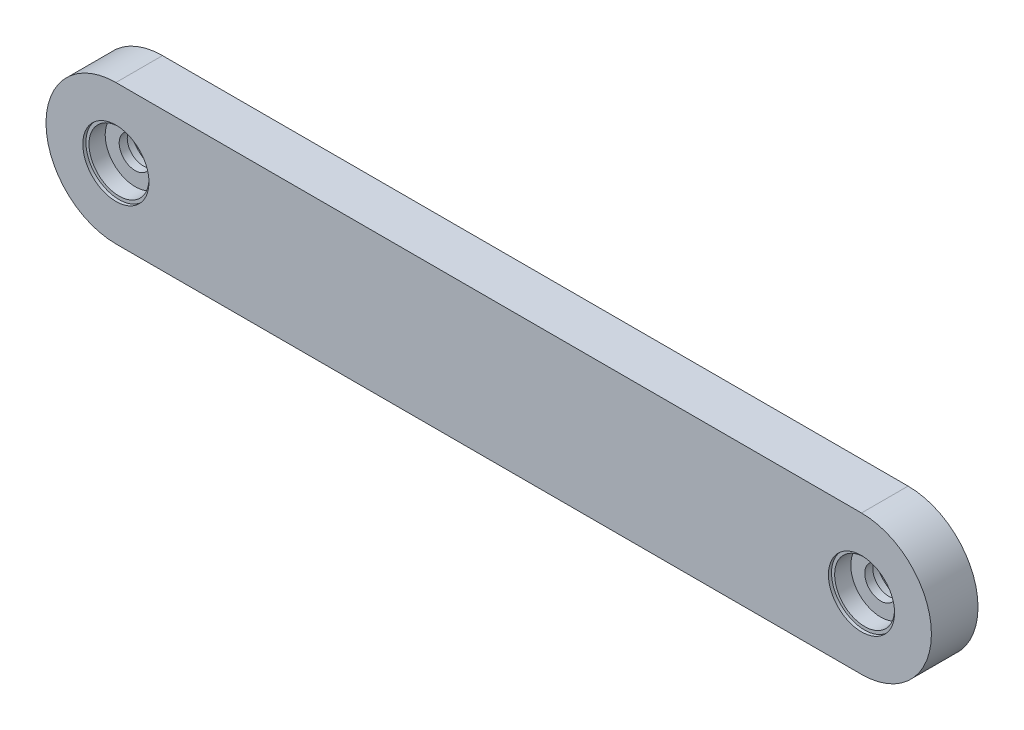
from build123d import *

# Parameters (mm, degrees)
EXTRUDE_1_DEPTH = 15


with BuildPart() as part:
    # 草图2 → 凸台-拉伸1 (new body)
    with BuildSketch(Plane.XY.offset(15)):
        with BuildLine():
            Line((0, -22.5), (240, -22.5))
            ThreePointArc((240, -22.5), (262.5, 0), (240, 22.5))
            Line((240, 22.5), (0, 22.5))
            ThreePointArc((0, 22.5), (-22.5, 0), (0, -22.5))
        make_face()
    extrude(amount=-EXTRUDE_1_DEPTH)

    # 草图3 → 切除-旋转1 (revolve, cut)
    with BuildSketch(Plane.XZ, mode=Mode.PRIVATE) as cut_revolve_1_sk:
        Polygon((250.65, 15), (240, 15), (240, 0), (250.65, 0), (250.65, 1), (249.65, 1), (249.65, 6.2), (245.15, 6.2), (245.15, 8.8), (249.65, 8.8), (249.65, 14), (250.65, 14), align=None)
    revolve(cut_revolve_1_sk.sketch.rotate(Axis((240, 0, 15), (0, 0, -1)), 180), axis=Axis((240, 0, 15), (0, 0, -1)), mode=Mode.SUBTRACT)

    # 草图4 → 切除-旋转2 (revolve, cut)
    with BuildSketch(Plane.XZ, mode=Mode.PRIVATE) as cut_revolve_2_sk:
        Polygon((10.65, 15), (0, 15), (0, 0), (10.65, 0), (10.65, 1), (9.65, 1), (9.65, 6.2), (5.15, 6.2), (5.15, 8.8), (9.65, 8.8), (9.65, 14), (10.65, 14), align=None)
    revolve(cut_revolve_2_sk.sketch.rotate(Axis((0, 0, 15), (0, 0, -1)), 180), axis=Axis((0, 0, 15), (0, 0, -1)), mode=Mode.SUBTRACT)


solid = part.part
